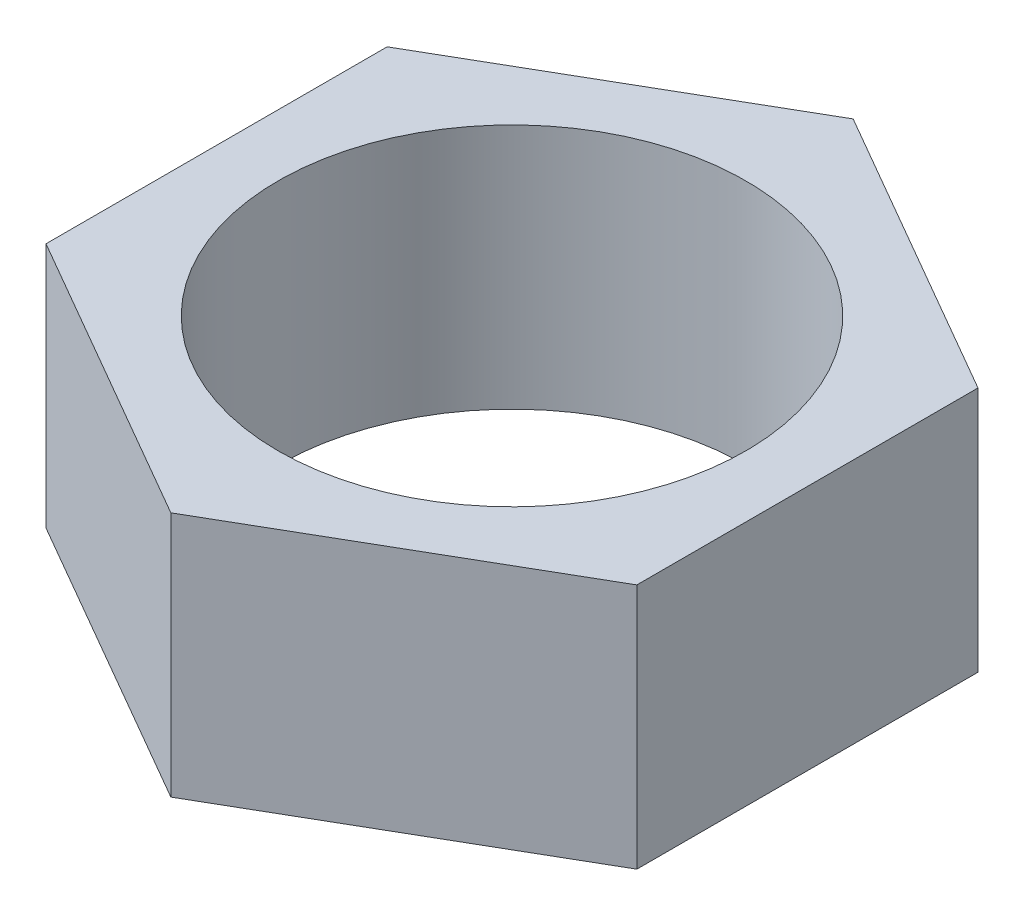
from build123d import *

# Parameters (mm, degrees)
SKETCH1_R           = 2.413
BOSS_EXTRUDE2_DEPTH = 2.54


with BuildPart() as part:
    # Sketch1 → Boss-Extrude2 (new body)
    with BuildSketch(Plane(origin=(0, 0, 0), x_dir=(1, 0, 0), z_dir=(0, 1, 0))):
        Polygon((-3.048, 1.75976362), (-3.048, -1.75976362), (0, -3.519527241), (3.048, -1.75976362), (3.048, 1.75976362), (0, 3.519527241), align=None)
        with Locations(Location((0, 0, 0), (0, 0, 270))):
            Circle(SKETCH1_R, mode=Mode.SUBTRACT)
    extrude(amount=BOSS_EXTRUDE2_DEPTH)


solid = part.part
